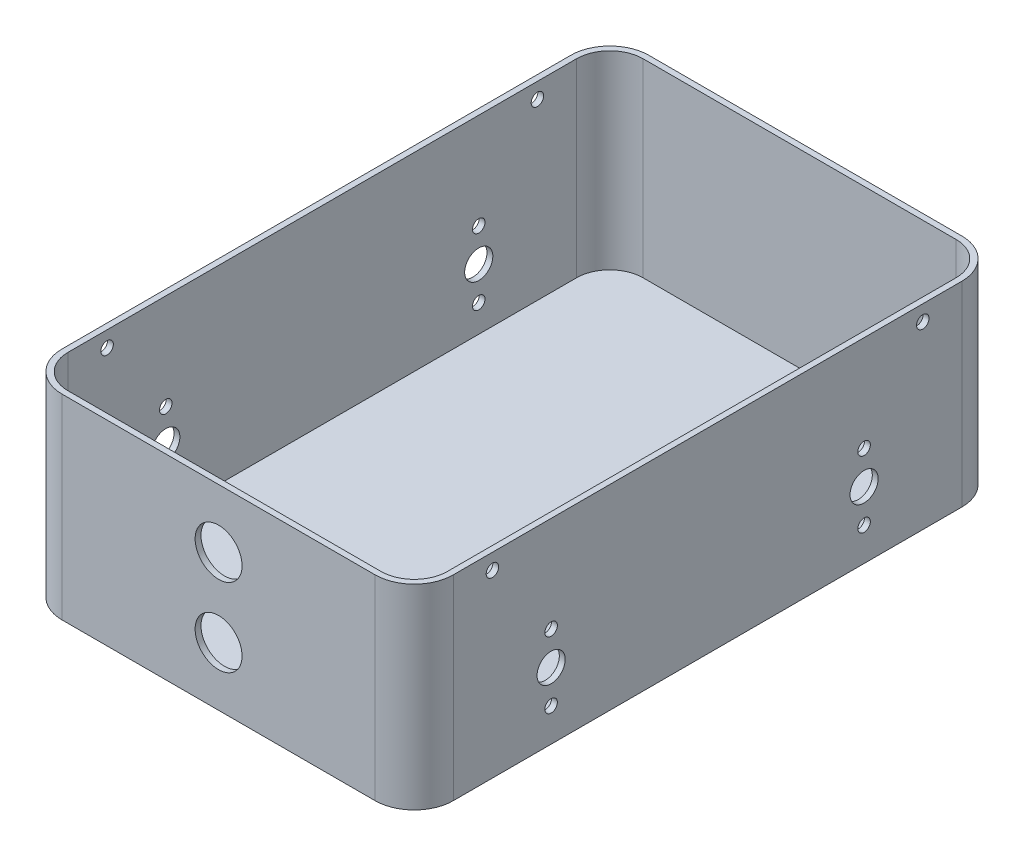
from build123d import *

# Parameters (mm, degrees)
EXTRUDE_1_DEPTH          = 50
SHELL_1_T                = -1.5
CUT_EXTRUDE_1_DEPTH      = 156.758548301
CUT_EXTRUDE_1_DEPTH_BACK = 156.758548301
SKETCH_4_R               = 3.6
SKETCH_4_R_2             = 1.6
CUT_EXTRUDE_2_REACH      = 189.083
SKETCH_6_R               = 6
SKETCH_7_R               = 1.6
CUT_EXTRUDE_3_DEPTH      = 156.758548301


with BuildPart() as part:
    # 草圖3 → 填料-伸長1 (new body)
    with BuildSketch(Plane(origin=(0, 0, 0), x_dir=(1, 0, 0), z_dir=(0, 1, 0))):
        with BuildLine():
            Line((10, 41.553121903), (90, 41.553121903))
            ThreePointArc((90, 41.553121903), (97.071067812, 38.624189715), (100, 31.553121903))
            Line((100, 31.553121903), (100, -98.446878097))
            ThreePointArc((100, -98.446878097), (97.071067812, -105.517945908), (90, -108.446878097))
            Line((90, -108.446878097), (10, -108.446878097))
            ThreePointArc((10, -108.446878097), (2.928932188, -105.517945908), (0, -98.446878097))
            Line((0, -98.446878097), (0, 31.553121903))
            ThreePointArc((0, 31.553121903), (2.928932188, 38.624189715), (10, 41.553121903))
        make_face()
    extrude(amount=EXTRUDE_1_DEPTH)

    # 薄殼1
    shell_1_openings = [part.faces().sort_by_distance(p)[0] for p in [
        (50, 50, 33.446878097),
    ]]
    offset(amount=SHELL_1_T, openings=shell_1_openings, kind=Kind.INTERSECTION)

    # 草圖4 → 除料-伸長1 (cut, two sides: drawn at the far end of the back side and taken through both)
    with BuildSketch(Plane.ZY.offset(-CUT_EXTRUDE_1_DEPTH_BACK)):
        with Locations((-6.553121903, 17)):
            Circle(SKETCH_4_R)
        with Locations((73.446878097, 17)):
            Circle(SKETCH_4_R)
        with Locations((-6.552300072, 25.5)):
            Circle(SKETCH_4_R_2)
        with Locations((-6.552300072, 8.5)):
            Circle(SKETCH_4_R_2)
        with Locations((73.447699928, 25.5)):
            Circle(SKETCH_4_R_2)
        with Locations((73.447699928, 8.5)):
            Circle(SKETCH_4_R_2)
    extrude(amount=CUT_EXTRUDE_1_DEPTH + CUT_EXTRUDE_1_DEPTH_BACK, mode=Mode.SUBTRACT)

    # 草圖6 → 除料-伸長2 (cut, up to next)
    with BuildSketch(Plane.XY.offset(108.446878097), mode=Mode.PRIVATE) as cut_extrude_2_sk1:
        with Locations((50, 35)):
            Circle(SKETCH_6_R)
    cut_extrude_2_tool1 = extrude(cut_extrude_2_sk1.sketch, amount=-CUT_EXTRUDE_2_REACH, mode=Mode.PRIVATE) & part.part
    # 草圖6 → 除料-伸長2 (cut, up to next)
    with BuildSketch(Plane.XY.offset(108.446878097), mode=Mode.PRIVATE) as cut_extrude_2_sk2:
        with Locations((50, 15)):
            Circle(SKETCH_6_R)
    cut_extrude_2_tool2 = extrude(cut_extrude_2_sk2.sketch, amount=-CUT_EXTRUDE_2_REACH, mode=Mode.PRIVATE) & part.part
    add(cut_extrude_2_tool1.solids().sort_by_distance((50, 35, 108.446878))[0], mode=Mode.SUBTRACT)
    add(cut_extrude_2_tool2.solids().sort_by_distance((50, 15, 108.446878))[0], mode=Mode.SUBTRACT)

    # 草圖7 → 除料-伸長3 (cut, through all)
    with BuildSketch(Plane(origin=(100, 0, 0), x_dir=(0, 0, -1), z_dir=(1, 0, 0))):
        with Locations((-88.446878097, 46)):
            Circle(SKETCH_7_R)
        with Locations((21.553121903, 46)):
            Circle(SKETCH_7_R)
    extrude(amount=-CUT_EXTRUDE_3_DEPTH, mode=Mode.SUBTRACT)


solid = part.part
